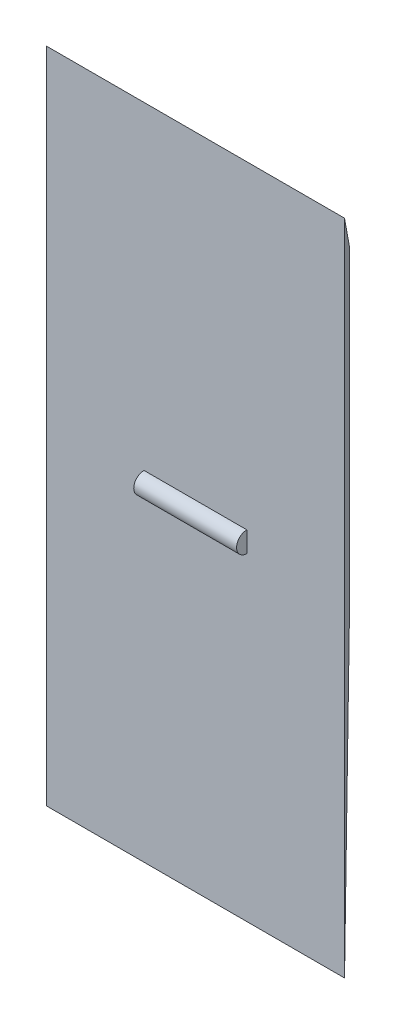
from build123d import *

# Parameters (mm, degrees)
BOSS_EXTRU_2_DEPTH      = 10
BOSS_EXTRU_2_DEPTH_BACK = 10
ESQUISSE4_R             = 2


with BuildPart() as part:
    # Esquisse2 → Lissage1 section 0
    with BuildSketch(Plane.XY.offset(30)):
        with BuildLine():
            Line((-14.5, -64), (-14.5, 64))
            Line((-14.5, 64), (43.5, 64))
            Line((43.5, 64), (43.5, -64))
            Line((43.5, -64), (-14.5, -64))
        make_face()
    # Esquisse1 → Lissage1 section 1
    with BuildSketch(Plane.XY):
        with BuildLine():
            Line((-14.5, 29.5), (14.5, 29.5))
            Line((14.5, 29.5), (14.5, -29.5))
            Line((14.5, -29.5), (-14.5, -29.5))
            Line((-14.5, -29.5), (-14.5, 29.5))
        make_face()
    loft()

    # Esquisse4 → Boss.-Extru.2 (add, two sides: drawn at the far end of the back side and taken through both)
    with BuildSketch(Plane(origin=(14.5, 0, 0), x_dir=(0, 0, -1), z_dir=(1, 0, 0)).offset(-BOSS_EXTRU_2_DEPTH_BACK)):
        with Locations((-30, 0)):
            Circle(ESQUISSE4_R)
    extrude(amount=BOSS_EXTRU_2_DEPTH + BOSS_EXTRU_2_DEPTH_BACK)


solid = part.part
